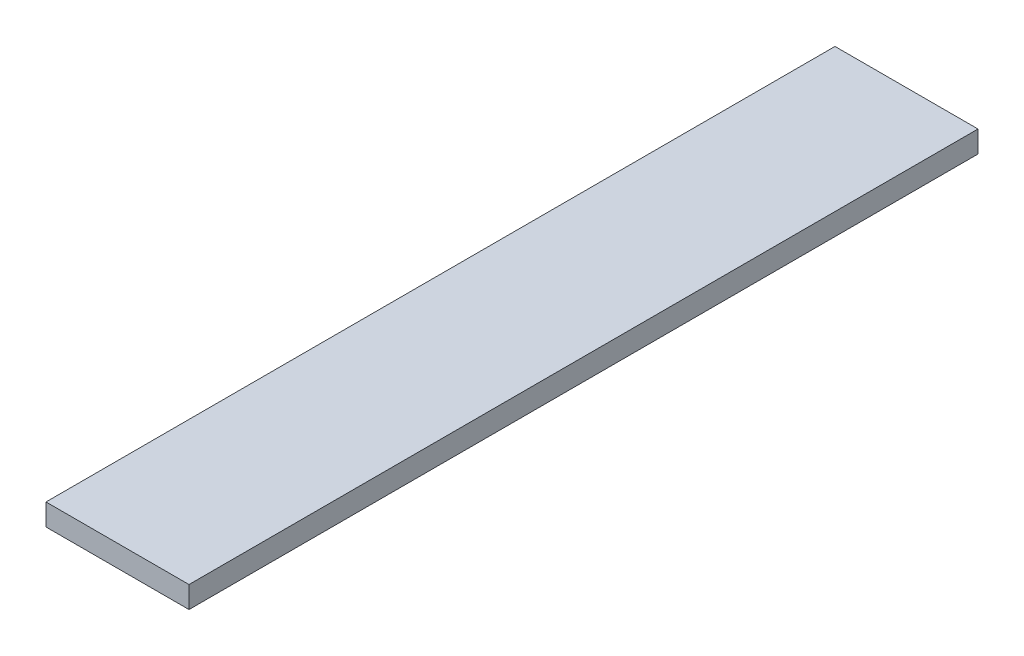
from build123d import *

# Parameters (mm, degrees)
IZIM1_W                     = 145
IZIM1_H                     = 800
Y_KSEKLIK_EKSTR_ZYON1_DEPTH = 22


with BuildPart() as part:
    # Çizim1 → Yükseklik-Ekstrüzyon1 (new body)
    with BuildSketch(Plane(origin=(0, 0, 0), x_dir=(1, 0, 0), z_dir=(0, 1, 0))):
        Rectangle(IZIM1_W, IZIM1_H)
    extrude(amount=Y_KSEKLIK_EKSTR_ZYON1_DEPTH)


solid = part.part
